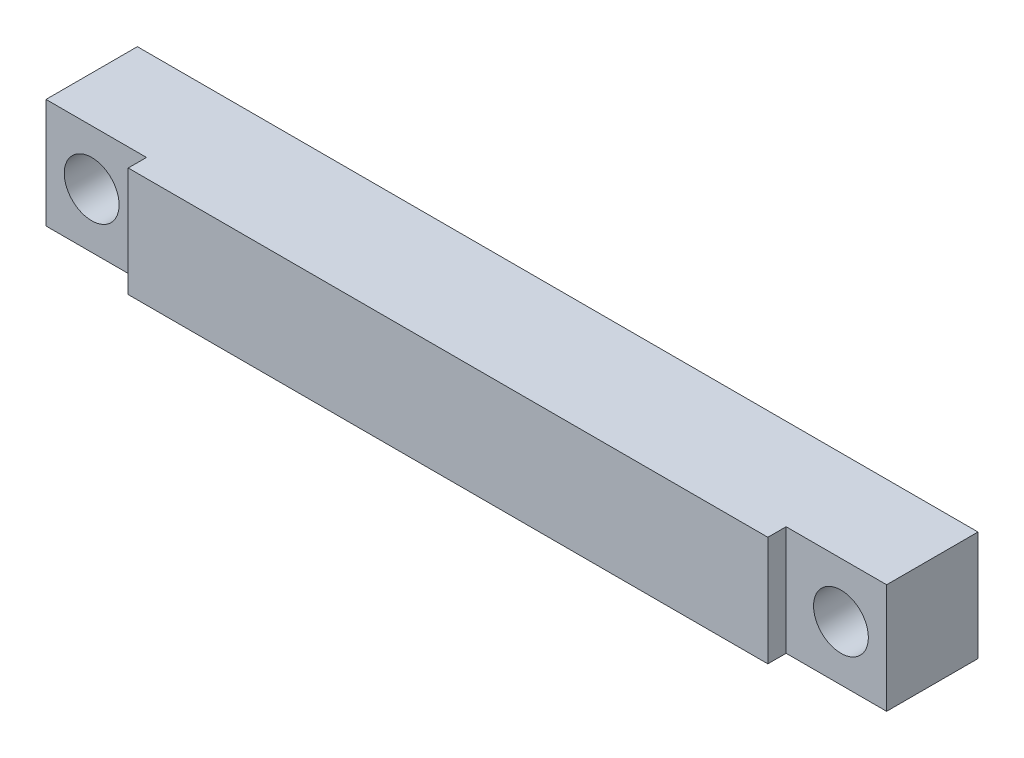
from build123d import *

# Parameters (mm, degrees)
SKETCH1_W           = 46
SKETCH1_H           = 6
SKETCH1_R           = 1.5
BOSS_EXTRUDE1_DEPTH = 5
SKETCH1_3_W         = 35
SKETCH1_3_H         = 6
BOSS_EXTRUDE2_DEPTH = 6


with BuildPart() as part:
    # Sketch1 → Boss-Extrude1 (new body)
    with BuildSketch(Plane.XY):
        Rectangle(SKETCH1_W, SKETCH1_H)
        with Locations((-20.5, 0)):
            Circle(SKETCH1_R, mode=Mode.SUBTRACT)
        with Locations((20.5, 0)):
            Circle(SKETCH1_R, mode=Mode.SUBTRACT)
    extrude(amount=BOSS_EXTRUDE1_DEPTH)

    # Sketch1<3> → Boss-Extrude2 (add)
    with BuildSketch(Plane.XY):
        Rectangle(SKETCH1_3_W, SKETCH1_3_H)
    extrude(amount=BOSS_EXTRUDE2_DEPTH)


solid = part.part
